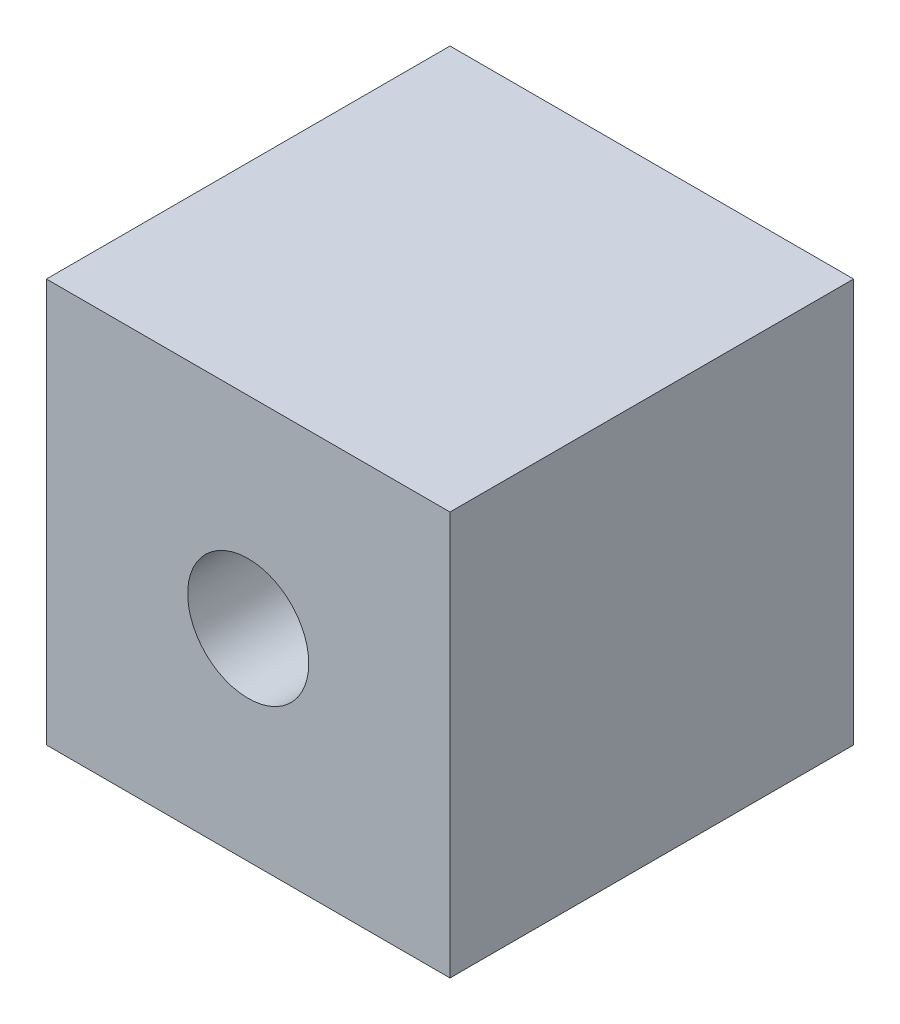
from build123d import *

# Parameters (mm, degrees)
SKETCH1_W           = 10
SKETCH1_H           = 10
BOSS_EXTRUDE1_DEPTH = 10
SKETCH2_R           = 1.5
CUT_EXTRUDE1_DEPTH  = 18.320508076


with BuildPart() as part:
    # Sketch1 → Boss-Extrude1 (new body)
    with BuildSketch(Plane.XY):
        with Locations((5, 5)):
            Rectangle(SKETCH1_W, SKETCH1_H)
    extrude(amount=BOSS_EXTRUDE1_DEPTH)

    # Sketch2 → Cut-Extrude1 (cut, through all)
    with BuildSketch(Plane.XY):
        with Locations((5, 5)):
            Circle(SKETCH2_R)
    extrude(amount=CUT_EXTRUDE1_DEPTH, mode=Mode.SUBTRACT)


solid = part.part
